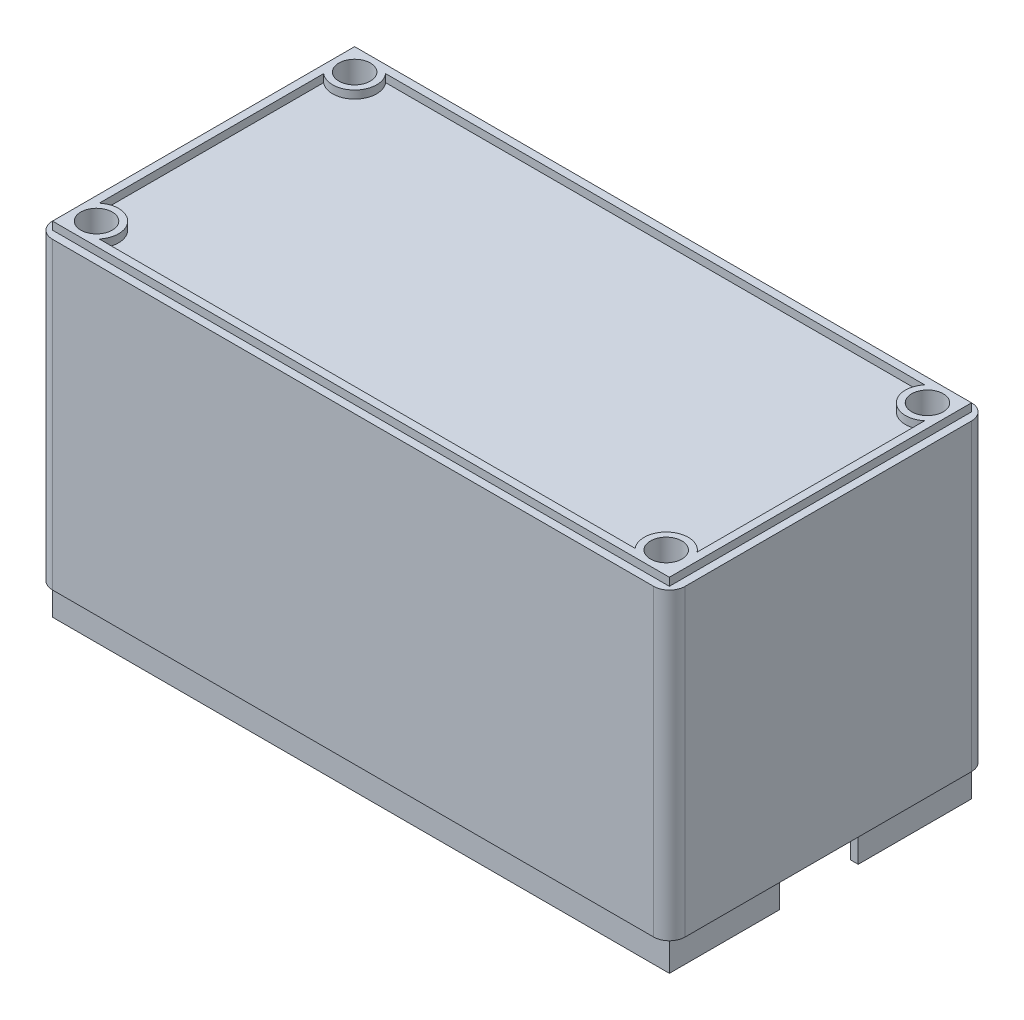
from build123d import *

# Parameters (mm, degrees)
SKETCH1_W           = 40.2
SKETCH1_H           = 20.2
SKETCH1_W_2         = 38.2
SKETCH1_H_2         = 18.2
BOSS_EXTRUDE1_DEPTH = 10.65
FILLET1_R           = 1
SKETCH2_W           = 39.2
SKETCH2_H           = 19.2
SKETCH2_W_2         = 38.2
SKETCH2_H_2         = 18.2
BOSS_EXTRUDE2_DEPTH = 0.5
SKETCH3_W           = 38.2
SKETCH3_H           = 18.2
BOSS_EXTRUDE3_DEPTH = 1
BOSS_EXTRUDE4_START = -21.8
SKETCH4_R           = 1.4
BOSS_EXTRUDE4_DEPTH = 21.8
SKETCH5_R           = 1
CUT_EXTRUDE1_DEPTH  = 34.690677644
SKETCH6_W           = 40.2
SKETCH6_H           = 20.2
SKETCH6_W_2         = 39.2
SKETCH6_H_2         = 19.2
CUT_EXTRUDE2_DEPTH  = 2
SKETCH7_W           = 5
SKETCH7_H           = 2
CUT_EXTRUDE3_DEPTH  = 0.5


with BuildPart() as part:
    # Sketch1 → Boss-Extrude1 (new, symmetric)
    with BuildSketch(Plane(origin=(0, 0, 0), x_dir=(1, 0, 0), z_dir=(0, 1, 0))):
        with Locations((3.133727572, 0.855166052)):
            Rectangle(SKETCH1_W, SKETCH1_H)
        with Locations((3.133727572, 0.855166052)):
            Rectangle(SKETCH1_W_2, SKETCH1_H_2, mode=Mode.SUBTRACT)
    extrude(amount=BOSS_EXTRUDE1_DEPTH, both=True)

    # Fillet1
    fillet1_edges = [part.edges().sort_by_distance(p)[0] for p in [
        (-16.966272428, 0, -10.955166052),
        (23.233727572, 0, -10.955166052),
        (23.233727572, 0, 9.244833948),
        (-16.966272428, 0, 9.244833948),
    ]]
    fillet(fillet1_edges, radius=FILLET1_R)

    # Sketch2 → Boss-Extrude2 (add)
    with BuildSketch(Plane(origin=(0, 10.65, 0), x_dir=(1, 0, 0), z_dir=(0, 1, 0))):
        with Locations((3.133727572, 0.855166052)):
            Rectangle(SKETCH2_W, SKETCH2_H)
        with Locations((3.133727572, 0.855166052)):
            Rectangle(SKETCH2_W_2, SKETCH2_H_2, mode=Mode.SUBTRACT)
    extrude(amount=BOSS_EXTRUDE2_DEPTH)

    # Sketch3 → Boss-Extrude3 (add)
    with BuildSketch(Plane(origin=(0, 10.65, 0), x_dir=(1, 0, 0), z_dir=(0, 1, 0))):
        with Locations((3.133727572, 0.855166052)):
            Rectangle(SKETCH3_W, SKETCH3_H)
    extrude(amount=-BOSS_EXTRUDE3_DEPTH)

    # Sketch4 → Boss-Extrude4 (add)
    with BuildSketch(Plane(origin=(0, 11.15, 0), x_dir=(1, 0, 0), z_dir=(0, 1, 0)).offset(BOSS_EXTRUDE4_START)):
        with Locations((-15.066272428, 9.055166052)):
            Circle(SKETCH4_R)
        with Locations((-15.066272428, -7.344833948)):
            Circle(SKETCH4_R)
        with Locations((21.333727572, 9.055166052)):
            Circle(SKETCH4_R)
        with Locations((21.133727572, -7.344833948)):
            Circle(SKETCH4_R)
    extrude(amount=BOSS_EXTRUDE4_DEPTH)

    # Sketch5 → Cut-Extrude1 (cut, through all)
    with BuildSketch(Plane(origin=(0, 11.15, 0), x_dir=(1, 0, 0), z_dir=(0, 1, 0))):
        with Locations(Location((-15.066272428, 9.055166052, 0), (0, 0, 270))):
            Circle(SKETCH5_R)
        with Locations(Location((-15.066272428, -7.344833948, 0), (0, 0, 270))):
            Circle(SKETCH5_R)
        with Locations(Location((21.333727572, 9.055166052, 0), (0, 0, 270))):
            Circle(SKETCH5_R)
        with Locations(Location((21.133727572, -7.344833948, 0), (0, 0, 270))):
            Circle(SKETCH5_R)
    extrude(amount=-CUT_EXTRUDE1_DEPTH, mode=Mode.SUBTRACT)

    # Sketch6 → Cut-Extrude2 (cut)
    with BuildSketch(Plane.XZ.offset(10.65)):
        with Locations((3.133727572, -0.855166052)):
            Rectangle(SKETCH6_W, SKETCH6_H)
        with Locations((3.133727572, -0.855166052)):
            Rectangle(SKETCH6_W_2, SKETCH6_H_2, mode=Mode.SUBTRACT)
    extrude(amount=-CUT_EXTRUDE2_DEPTH, mode=Mode.SUBTRACT)

    # Sketch7 → Cut-Extrude3 (cut)
    with BuildSketch(Plane(origin=(22.733727572, 0, 0), x_dir=(0, 0, -1), z_dir=(1, 0, 0))):
        with Locations((0.755166052, -9.65)):
            Rectangle(SKETCH7_W, SKETCH7_H)
    extrude(amount=-CUT_EXTRUDE3_DEPTH, mode=Mode.SUBTRACT)


solid = part.part
